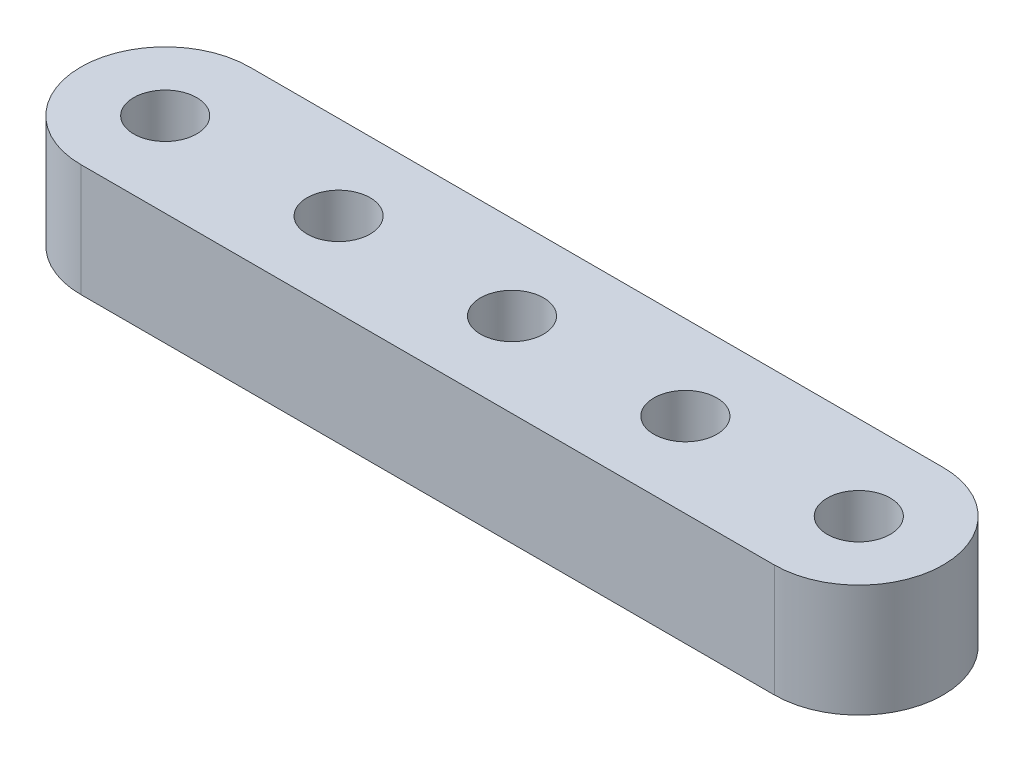
from build123d import *

# Parameters (mm, degrees)
SKETCH1_R           = 1.778
BOSS_EXTRUDE1_DEPTH = 6.35


with BuildPart() as part:
    # Sketch1 → Boss-Extrude1 (new body)
    with BuildSketch(Plane(origin=(0, 6.35, 0), x_dir=(1, 0, 0), z_dir=(0, 1, 0))):
        with BuildLine():
            Line((19.558, 4.7625), (-19.558, 4.7625))
            ThreePointArc((-19.558, 4.7625), (-24.3205, 0), (-19.558, -4.7625))
            Line((-19.558, -4.7625), (19.558, -4.7625))
            ThreePointArc((19.558, -4.7625), (24.3205, 0), (19.558, 4.7625))
        make_face()
        with Locations(Location((19.558, 0, 0), (0, 0, 90))):
            Circle(SKETCH1_R, mode=Mode.SUBTRACT)
        with Locations(Location((9.779, 0, 0), (0, 0, 90))):
            Circle(SKETCH1_R, mode=Mode.SUBTRACT)
        with Locations(Location((0, 0, 0), (0, 0, 90))):
            Circle(SKETCH1_R, mode=Mode.SUBTRACT)
        with Locations(Location((-9.779, 0, 0), (0, 0, 90))):
            Circle(SKETCH1_R, mode=Mode.SUBTRACT)
        with Locations(Location((-19.558, 0, 0), (0, 0, 90))):
            Circle(SKETCH1_R, mode=Mode.SUBTRACT)
    extrude(amount=-BOSS_EXTRUDE1_DEPTH)


solid = part.part
